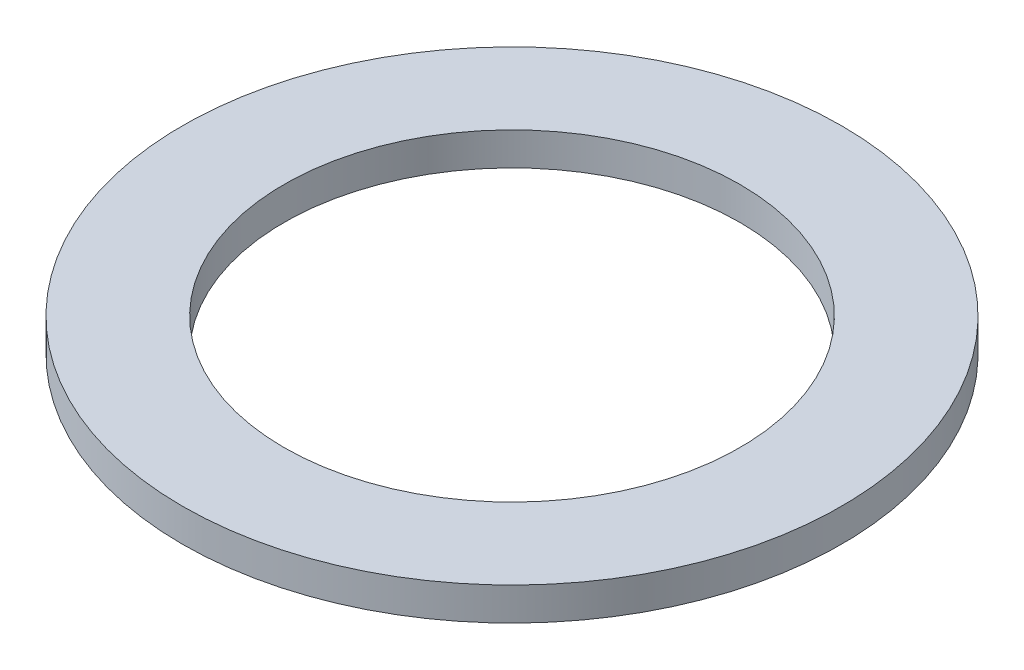
from build123d import *

# Parameters (mm, degrees)
SKETCH1_R           = 30
SKETCH1_R_2         = 20.75
BOSS_EXTRUDE1_DEPTH = 3


with BuildPart() as part:
    # Sketch1 → Boss-Extrude1 (new body)
    with BuildSketch(Plane(origin=(0, 0, 0), x_dir=(1, 0, 0), z_dir=(0, 1, 0))):
        with Locations(Location((0, 0, 0), (0, 0, 270))):
            Circle(SKETCH1_R)
        with Locations(Location((0, 0, 0), (0, 0, 270))):
            Circle(SKETCH1_R_2, mode=Mode.SUBTRACT)
    extrude(amount=BOSS_EXTRUDE1_DEPTH)


solid = part.part
